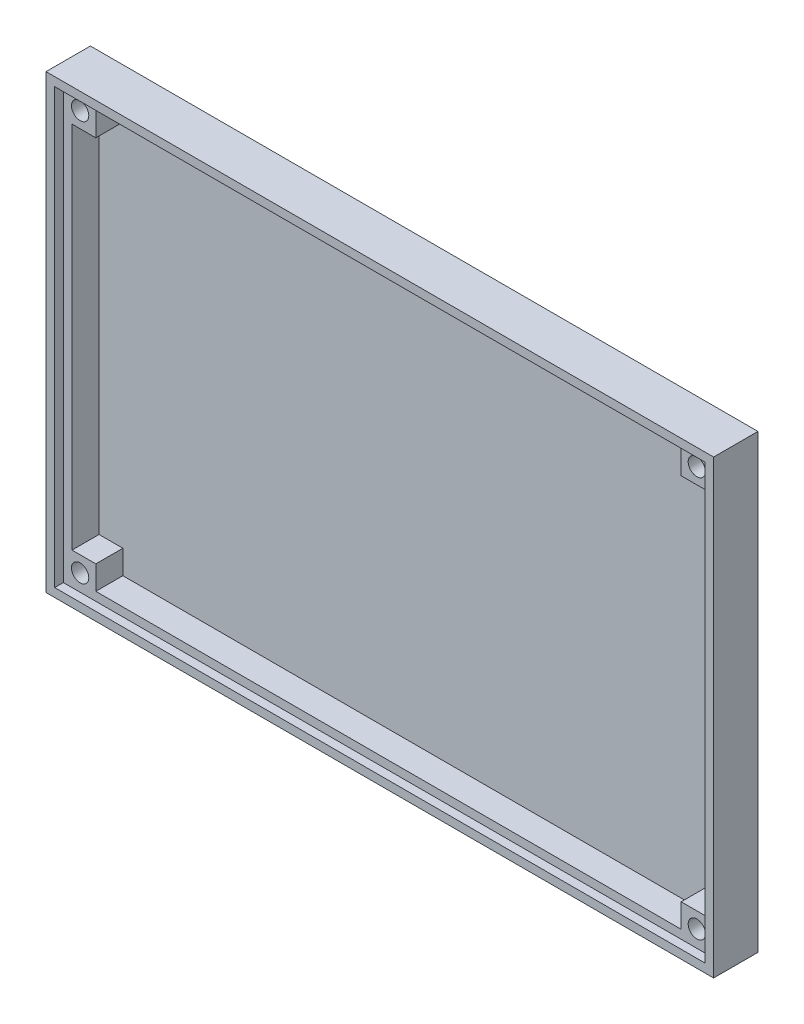
from build123d import *

# Parameters (mm, degrees)
SKETCH1_W           = 120.2
SKETCH1_H           = 80.2
BOSS_EXTRUDE1_DEPTH = 1.6
SKETCH2_W           = 123.4
SKETCH2_H           = 83.4
SKETCH2_W_2         = 120.2
SKETCH2_H_2         = 80.2
BOSS_EXTRUDE2_DEPTH = 8.2
SKETCH3_W           = 120.2
SKETCH3_H           = 80.2
BOSS_EXTRUDE3_DEPTH = 5
SKETCH4_R           = 1.6
CUT_EXTRUDE1_DEPTH  = 5


with BuildPart() as part:
    # Sketch1 → Boss-Extrude1 (new body)
    with BuildSketch(Plane.XY):
        Rectangle(SKETCH1_W, SKETCH1_H)
    extrude(amount=BOSS_EXTRUDE1_DEPTH)

    # Sketch2 → Boss-Extrude2 (add)
    with BuildSketch(Plane.XY):
        Rectangle(SKETCH2_W, SKETCH2_H)
        Rectangle(SKETCH2_W_2, SKETCH2_H_2, mode=Mode.SUBTRACT)
    extrude(amount=BOSS_EXTRUDE2_DEPTH)

    # Sketch3 → Boss-Extrude3 (add)
    with BuildSketch(Plane.XY.offset(1.6)):
        Rectangle(SKETCH3_W, SKETCH3_H)
        Polygon((-58.5, 34.1), (-54.1, 34.1), (-54.1, 38.5), (54.1, 38.5), (54.1, 34.1), (58.5, 34.1), (58.5, -34.1), (54.1, -34.1), (54.1, -38.5), (-54.1, -38.5), (-54.1, -34.1), (-58.5, -34.1), align=None, mode=Mode.SUBTRACT)
    extrude(amount=BOSS_EXTRUDE3_DEPTH)

    # Sketch4 → Cut-Extrude1 (cut)
    with BuildSketch(Plane.XY.offset(6.6)):
        with Locations((-57, 37)):
            Circle(SKETCH4_R)
        with Locations((57, 37)):
            Circle(SKETCH4_R)
        with Locations((57, -37)):
            Circle(SKETCH4_R)
        with Locations((-57, -37)):
            Circle(SKETCH4_R)
    extrude(amount=-CUT_EXTRUDE1_DEPTH, mode=Mode.SUBTRACT)


solid = part.part
